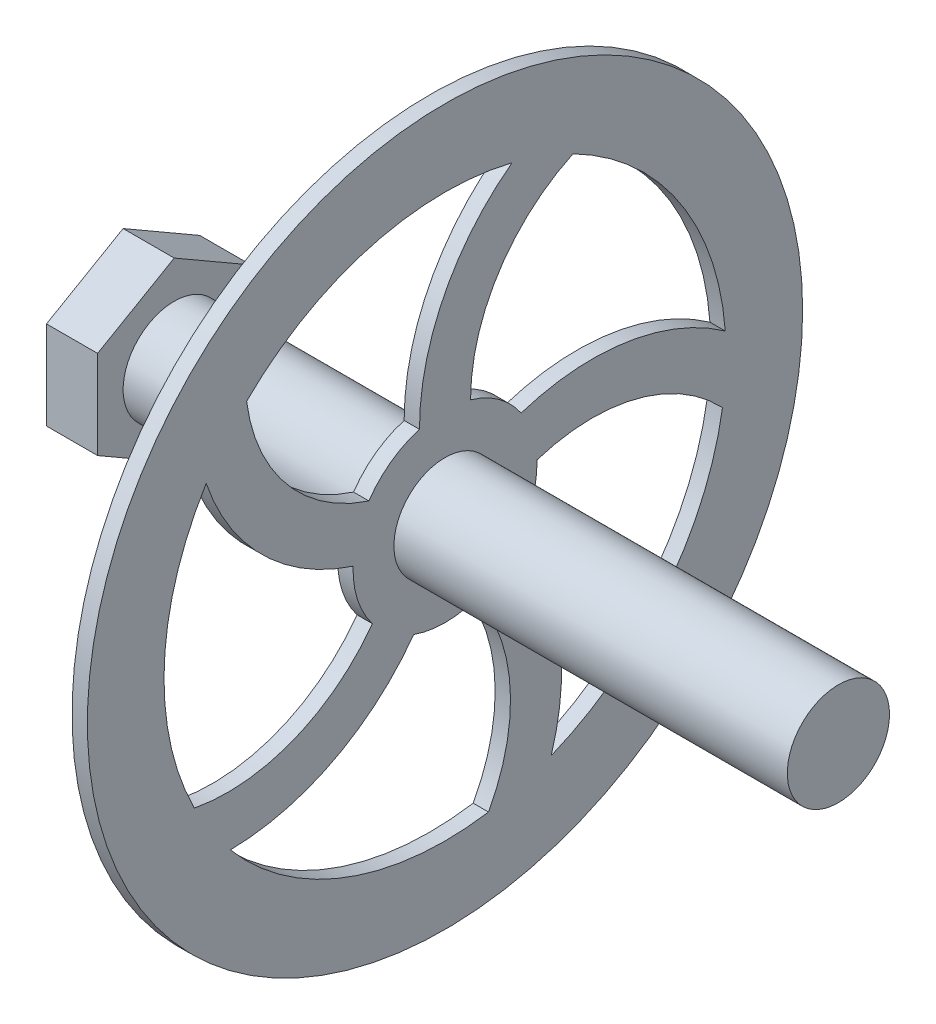
from build123d import *

# Parameters (mm, degrees)
SKETCH1_R           = 10
BOSS_EXTRUDE1_DEPTH = 130
BOSS_EXTRUDE2_DEPTH = 10
BOSS_EXTRUDE3_START = 50
SKETCH3_R           = 70
SKETCH3_R_2         = 10
BOSS_EXTRUDE3_DEPTH = 3


with BuildPart() as part:
    # Sketch1 → Boss-Extrude1 (new body)
    with BuildSketch(Plane(origin=(0, 0, 0), x_dir=(0, 0, -1), z_dir=(1, 0, 0))):
        Circle(SKETCH1_R)
    extrude(amount=BOSS_EXTRUDE1_DEPTH)

    # Sketch2 → Boss-Extrude2 (add)
    with BuildSketch(Plane.ZY):
        Polygon((0, 17.320508076), (-15, 8.660254038), (-15, -8.660254038), (0, -17.320508076), (15, -8.660254038), (15, 8.660254038), align=None)
    extrude(amount=BOSS_EXTRUDE2_DEPTH)


with BuildPart() as body_2:
    # Sketch3 → Boss-Extrude3 (new body)
    with BuildSketch(Plane(origin=(0, 0, 0), x_dir=(0, 0, -1), z_dir=(1, 0, 0)).offset(BOSS_EXTRUDE3_START)):
        Circle(SKETCH3_R)
        Circle(SKETCH3_R_2, mode=Mode.SUBTRACT)
        with BuildLine():
            ThreePointArc((13.122046564, 53.411720567), (-14.747190765, 52.986039336), (-38.829078481, 38.952569419))
            ThreePointArc((-38.829078481, 38.952569419), (-31.053051118, 21.052137421), (-14.900212579, 10.098696208))
            ThreePointArc((-14.900212579, 10.098696208), (-10.580125614, 14.562312385), (-4.999990727, 17.291619147))
            ThreePointArc((-4.999990727, 17.291619147), (-0.221575627, 37.50032111), (13.122046564, 53.411720567))
        make_face(mode=Mode.SUBTRACT)
        with BuildLine():
            ThreePointArc((5.000011927, 17.291613017), (10.425851953, 36.038674848), (25.047249846, 48.965654036))
            ThreePointArc((25.047249846, 48.965654036), (45.835585418, 30.398998494), (54.852500281, 4.025321462))
            ThreePointArc((54.852500281, 4.025321462), (35.59645412, 11.798967461), (14.900224961, 10.098677939))
            ThreePointArc((14.900224961, 10.098677939), (10.580143468, 14.562299413), (5.000011927, 17.291613017))
        make_face(mode=Mode.SUBTRACT)
        with BuildLine():
            ThreePointArc((17.990389895, 0.588108357), (37.496581987, 1.220988545), (54.30913021, -8.690130944))
            ThreePointArc((54.30913021, -8.690130944), (43.075140448, -34.198425043), (20.778662977, -50.923935088))
            ThreePointArc((20.778662977, -50.923935088), (22.221394152, -30.208158187), (14.208836193, -11.050292939))
            ThreePointArc((14.208836193, -11.050292939), (17.119013883, -5.562316393), (17.990389895, 0.588108357))
        make_face(mode=Mode.SUBTRACT)
        with BuildLine():
            ThreePointArc((6.118660498, -16.928142063), (12.748310177, -35.284062427), (8.517638523, -54.336450326))
            ThreePointArc((8.517638523, -54.336450326), (-19.213684551, -51.534787532), (-42.010580321, -35.498044187))
            ThreePointArc((-42.010580321, -35.498044187), (-21.862877257, -30.468635958), (-6.118681253, -16.928134561))
            ThreePointArc((-6.118681253, -16.928134561), (-1.1035e-05, -18), (6.118660498, -16.928142063))
        make_face(mode=Mode.SUBTRACT)
        with BuildLine():
            ThreePointArc((-14.208849741, -11.050275519), (-29.617692999, -23.027738386), (-49.044940099, -24.891642186))
            ThreePointArc((-49.044940099, -24.891642186), (-54.949850549, 2.348174745), (-46.742629503, 28.984937246))
            ThreePointArc((-46.742629503, 28.984937246), (-35.733395389, 11.377505574), (-17.990389174, 0.588130414))
            ThreePointArc((-17.990389174, 0.588130414), (-17.119020703, -5.562295404), (-14.208849741, -11.050275519))
        make_face(mode=Mode.SUBTRACT)
    extrude(amount=BOSS_EXTRUDE3_DEPTH)


solid = Compound([part.part, body_2.part])
